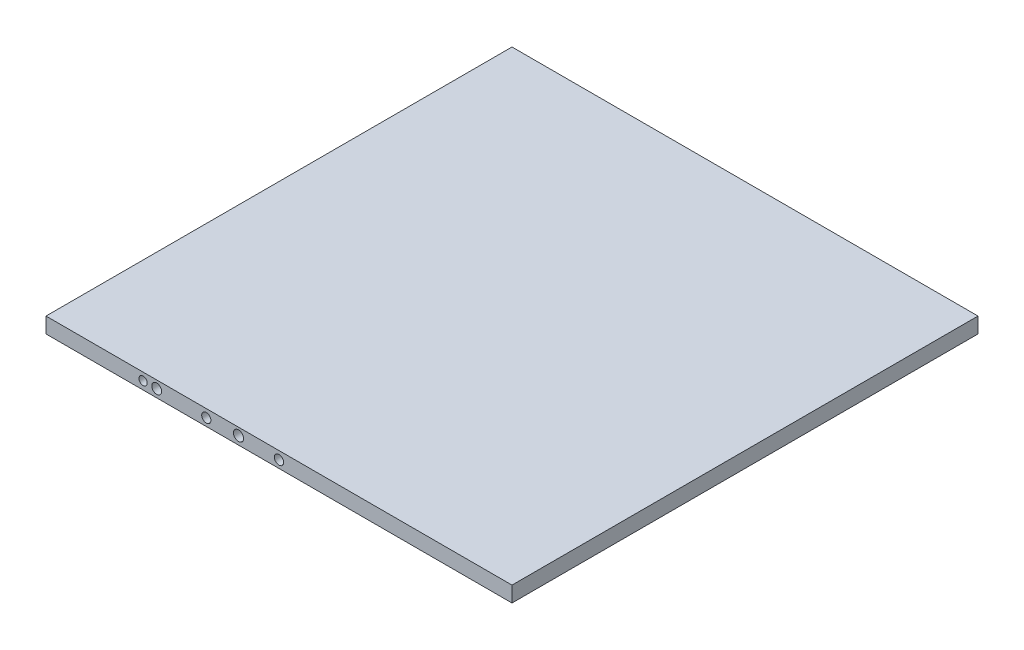
from build123d import *

# Parameters (mm, degrees)
SKETCH1_W               = 304.8
SKETCH1_H               = 304.8
BOSS_EXTRUDE1_DEPTH     = 10.16
CUT_EXTRUDE1_DEPTH      = 223.167807436
CUT_EXTRUDE1_DEPTH_BACK = 223.167807436
SKETCH2_R               = 3.04
SKETCH4_R               = 3.2281005
CUT_EXTRUDE3_DEPTH      = 345.170558112
CUT_EXTRUDE4_DEPTH      = 345.170558112
CUT_EXTRUDE4_DEPTH_BACK = 345.170558112
SKETCH5_R               = 3.308101134
CUT_EXTRUDE5_DEPTH      = 345.170558112
CUT_EXTRUDE5_DEPTH_BACK = 345.170558112
SKETCH3_R               = 3
SKETCH6_R               = 2.704571709
CUT_EXTRUDE6_DEPTH      = 345.170558112


with BuildPart() as part:
    # Sketch1 → Boss-Extrude1 (new body)
    with BuildSketch(Plane(origin=(0, 0, 0), x_dir=(1, 0, 0), z_dir=(0, 1, 0))):
        with Locations((-7.121495327, 1.899065421)):
            Rectangle(SKETCH1_W, SKETCH1_H)
    extrude(amount=BOSS_EXTRUDE1_DEPTH)

    # Sketch2 → Cut-Extrude1 (cut, two sides: drawn at the far end of the back side and taken through both)
    with BuildSketch(Plane.XY.offset(-CUT_EXTRUDE1_DEPTH_BACK)):
        with Locations((-7.121495327, 4.941750029)):
            Circle(SKETCH2_R)
    extrude(amount=CUT_EXTRUDE1_DEPTH + CUT_EXTRUDE1_DEPTH_BACK, mode=Mode.SUBTRACT)

    # Sketch4 → Cut-Extrude3 (cut, through all)
    with BuildSketch(Plane.XY.offset(150.500934579)):
        with Locations((-87.118814918, 5.218403667)):
            Circle(SKETCH4_R)
    extrude(amount=-CUT_EXTRUDE3_DEPTH, mode=Mode.SUBTRACT)

    # Sketch5 → Cut-Extrude4 (cut, two sides: drawn at the far end of the back side and taken through both)
    with BuildSketch(Plane.XY.offset(150.500934579).offset(-CUT_EXTRUDE4_DEPTH_BACK)):
        with Locations((-33.586304402, 5.334469318)):
            Circle(SKETCH5_R)
    extrude(amount=CUT_EXTRUDE4_DEPTH + CUT_EXTRUDE4_DEPTH_BACK, mode=Mode.SUBTRACT)

    # Sketch3 → Cut-Extrude5 (cut, two sides: drawn at the far end of the back side and taken through both)
    with BuildSketch(Plane.XY.offset(150.500934579).offset(-CUT_EXTRUDE5_DEPTH_BACK)):
        with Locations((-54.67948523, 4.941750029)):
            Circle(SKETCH3_R)
    extrude(amount=CUT_EXTRUDE5_DEPTH + CUT_EXTRUDE5_DEPTH_BACK, mode=Mode.SUBTRACT)

    # Sketch6 → Cut-Extrude6 (cut, through all)
    with BuildSketch(Plane.XY.offset(150.500934579)):
        with Locations((-96.021495327, 5.218403667)):
            Circle(SKETCH6_R)
    extrude(amount=-CUT_EXTRUDE6_DEPTH, mode=Mode.SUBTRACT)


solid = part.part
